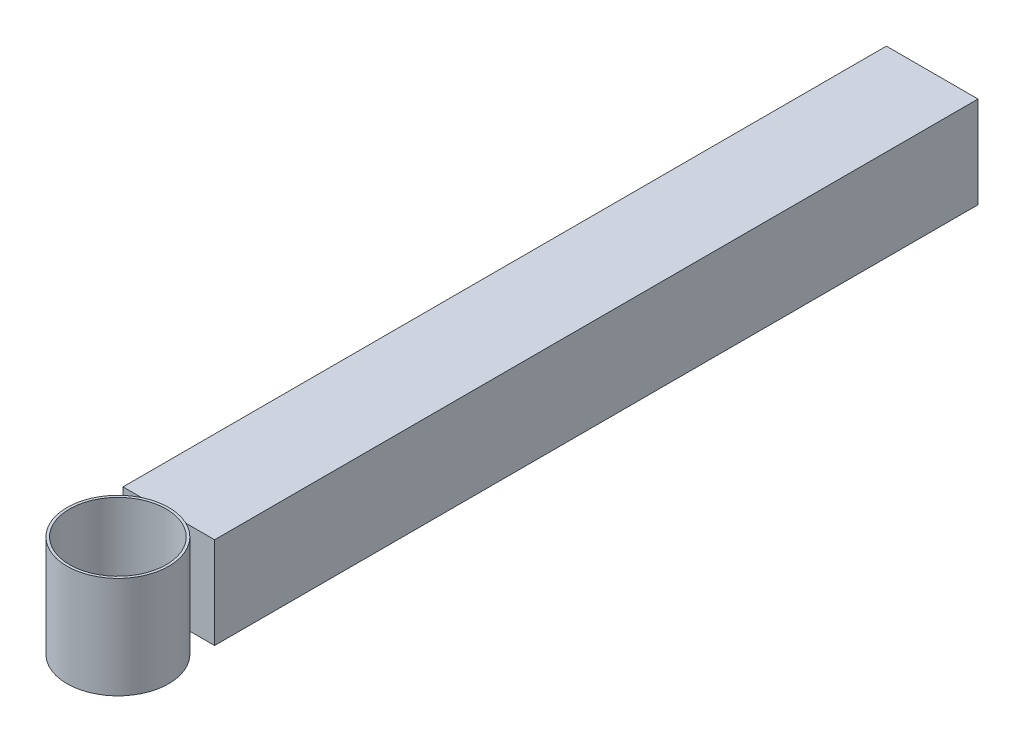
from build123d import *

# Parameters (mm, degrees)
SKETCH1_W                = 36
SKETCH1_H                = 36
BOSS_EXTRUDE1_DEPTH      = 300
BOSS_EXTRUDE2_DEPTH      = 20
BOSS_EXTRUDE2_DEPTH_BACK = 20
SKETCH2_R                = 20
SKETCH2_R_2              = 19


with BuildPart() as part:
    # Sketch1 → Boss-Extrude1 (new body)
    with BuildSketch(Plane.XY):
        Rectangle(SKETCH1_W, SKETCH1_H)
    extrude(amount=BOSS_EXTRUDE1_DEPTH)


with BuildPart() as body_2:
    # Sketch2 → Boss-Extrude2 (new, two sides: drawn at the far end of the back side and taken through both)
    with BuildSketch(Plane(origin=(0, 0, 0), x_dir=(1, 0, 0), z_dir=(0, 1, 0)).offset(-BOSS_EXTRUDE2_DEPTH_BACK)):
        with Locations(Location((0, -320, 0), (0, 0, 270))):
            Circle(SKETCH2_R)
        with Locations(Location((0, -320, 0), (0, 0, 270))):
            Circle(SKETCH2_R_2, mode=Mode.SUBTRACT)
    extrude(amount=BOSS_EXTRUDE2_DEPTH + BOSS_EXTRUDE2_DEPTH_BACK)


solid = Compound([part.part, body_2.part])
